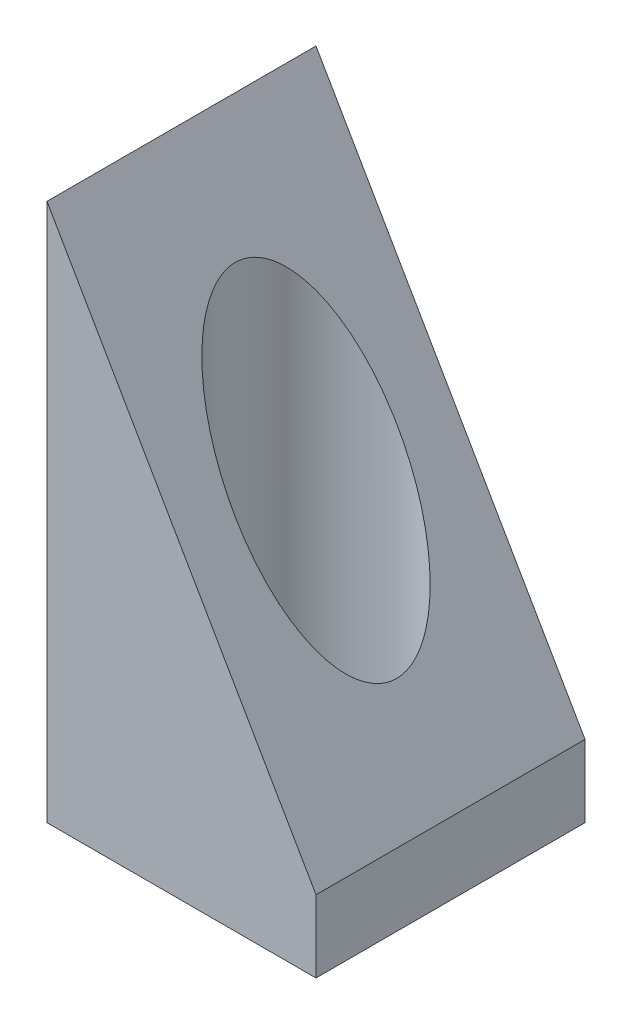
from build123d import *

# Parameters (mm, degrees)
SKETCH_1_W               = 40
SKETCH_1_H               = 40
SKETCH_1_R               = 12
EXTRUDE_1_DEPTH          = 80
CUT_EXTRUDE_2_DEPTH      = 85.852813742
CUT_EXTRUDE_2_DEPTH_BACK = 85.852813742


with BuildPart() as part:
    # 草圖1 → 填料-伸長1 (new body)
    with BuildSketch(Plane(origin=(0, 0, 0), x_dir=(1, 0, 0), z_dir=(0, 1, 0))):
        Rectangle(SKETCH_1_W, SKETCH_1_H)
        with Locations(Location((0, 0, 0), (0, 0, 270))):
            Circle(SKETCH_1_R, mode=Mode.SUBTRACT)
    extrude(amount=EXTRUDE_1_DEPTH)

    # 草圖2 → 除料-伸長2 (cut, two sides: drawn at the far end of the back side and taken through both)
    with BuildSketch(Plane.XY.offset(-CUT_EXTRUDE_2_DEPTH_BACK)):
        Polygon((114.4427191, -152.861620189), (20, 10.717967697), (-20, 80), (-114.4427191, 243.579587886), (212.716456672, 432.465026086), (441.601894872, 36.023818011), align=None)
    extrude(amount=CUT_EXTRUDE_2_DEPTH + CUT_EXTRUDE_2_DEPTH_BACK, mode=Mode.SUBTRACT)


solid = part.part
